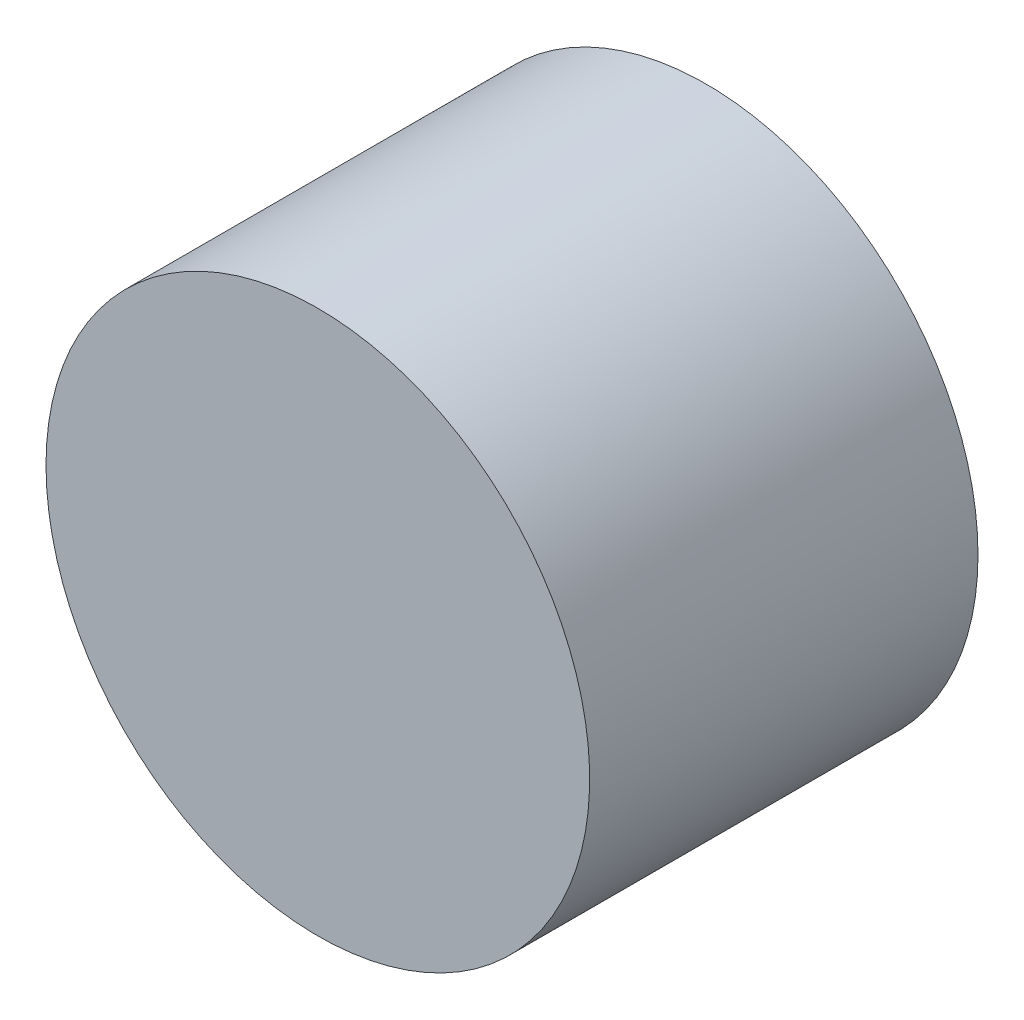
from build123d import *

# Parameters (mm, degrees)
ESBO_O1_R                    = 35
RESSALTO_EXTRUS_O1_DEPTH     = 50
FURO_ROSCADO_DE_M101_D       = 8.5
FURO_ROSCADO_DE_M101_DEPTH   = 27.5
FURO_ROSCADO_DE_M101_TIP     = 2.553657631
FUROS_GUIA_COM_10_0MM1_D     = 10
FUROS_GUIA_COM_10_0MM1_DEPTH = 27.5
FUROS_GUIA_COM_10_0MM1_TIP   = 3.004303095


with BuildPart() as part:
    # Esboço1 → Ressalto-extrusão1 (new body)
    with BuildSketch(Plane.XY):
        with Locations(Location((0, -240, 0), (0, 0, 180))):
            Circle(ESBO_O1_R)
    extrude(amount=RESSALTO_EXTRUS_O1_DEPTH)

    # Furo roscado de M101
    with Locations(Plane(origin=(0, 0, 0), x_dir=(-1, 0, 0), z_dir=(0, 0, -1))):
        with Locations((0, -220), (17.320508076, -250), (-17.320508076, -250)):
            Hole(FURO_ROSCADO_DE_M101_D / 2, depth=FURO_ROSCADO_DE_M101_DEPTH)
            with Locations((0, 0, -(FURO_ROSCADO_DE_M101_DEPTH + FURO_ROSCADO_DE_M101_TIP / 2))):  # 118° drill point
                Cone(0, FURO_ROSCADO_DE_M101_D / 2, FURO_ROSCADO_DE_M101_TIP, mode=Mode.SUBTRACT)

    # Furos-guia com Ø10.0mm1
    with Locations(Plane(origin=(0, 0, 0), x_dir=(-1, 0, 0), z_dir=(0, 0, -1))):
        with Locations((20, -230), (-20, -230)):
            Hole(FUROS_GUIA_COM_10_0MM1_D / 2, depth=FUROS_GUIA_COM_10_0MM1_DEPTH)
            with Locations((0, 0, -(FUROS_GUIA_COM_10_0MM1_DEPTH + FUROS_GUIA_COM_10_0MM1_TIP / 2))):  # 118° drill point
                Cone(0, FUROS_GUIA_COM_10_0MM1_D / 2, FUROS_GUIA_COM_10_0MM1_TIP, mode=Mode.SUBTRACT)


solid = part.part
